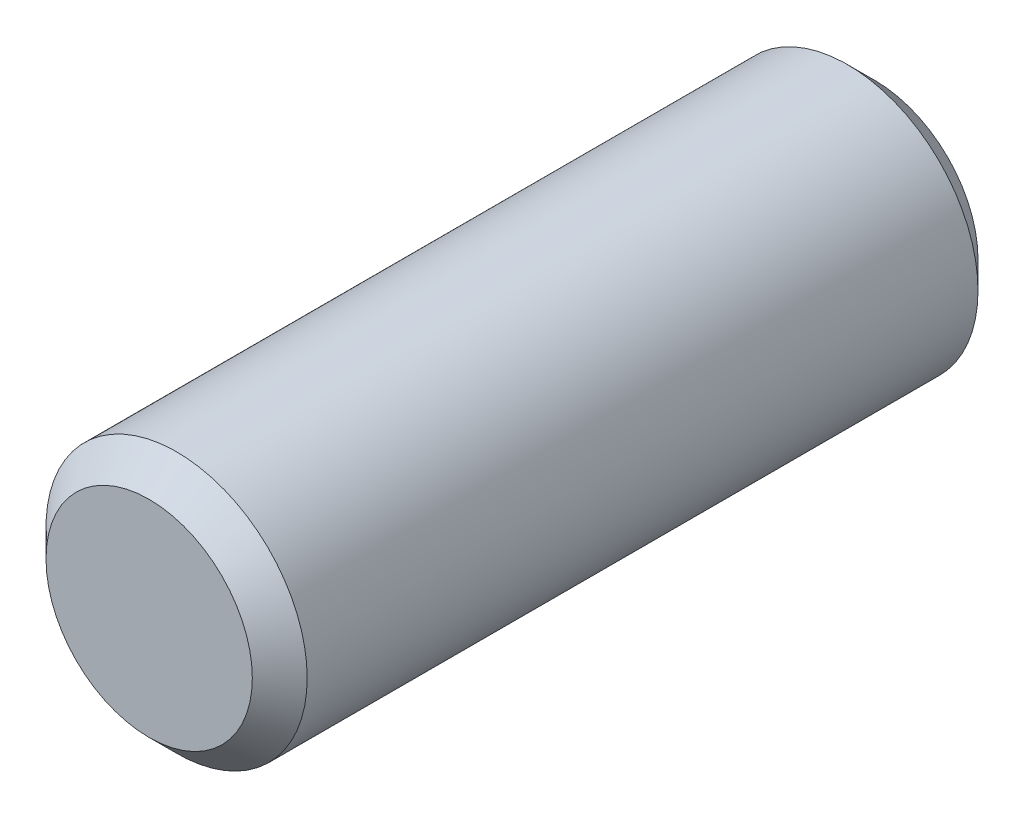
from build123d import *

# Parameters (mm, degrees)
SKETCH1_R           = 9.52
BOSS_EXTRUDE1_DEPTH = 26.45
CHAMFER1_SIZE       = 2


with BuildPart() as part:
    # Sketch1 → Boss-Extrude1 (new, symmetric)
    with BuildSketch(Plane.XY):
        Circle(SKETCH1_R)
    extrude(amount=BOSS_EXTRUDE1_DEPTH, both=True)

    # Chamfer1
    chamfer1_edges = [part.edges().sort_by_distance(p)[0] for p in [
        (-9.52, 0, -26.45),
        (-9.52, 0, 26.45),
    ]]
    chamfer(chamfer1_edges, length=CHAMFER1_SIZE)


solid = part.part
